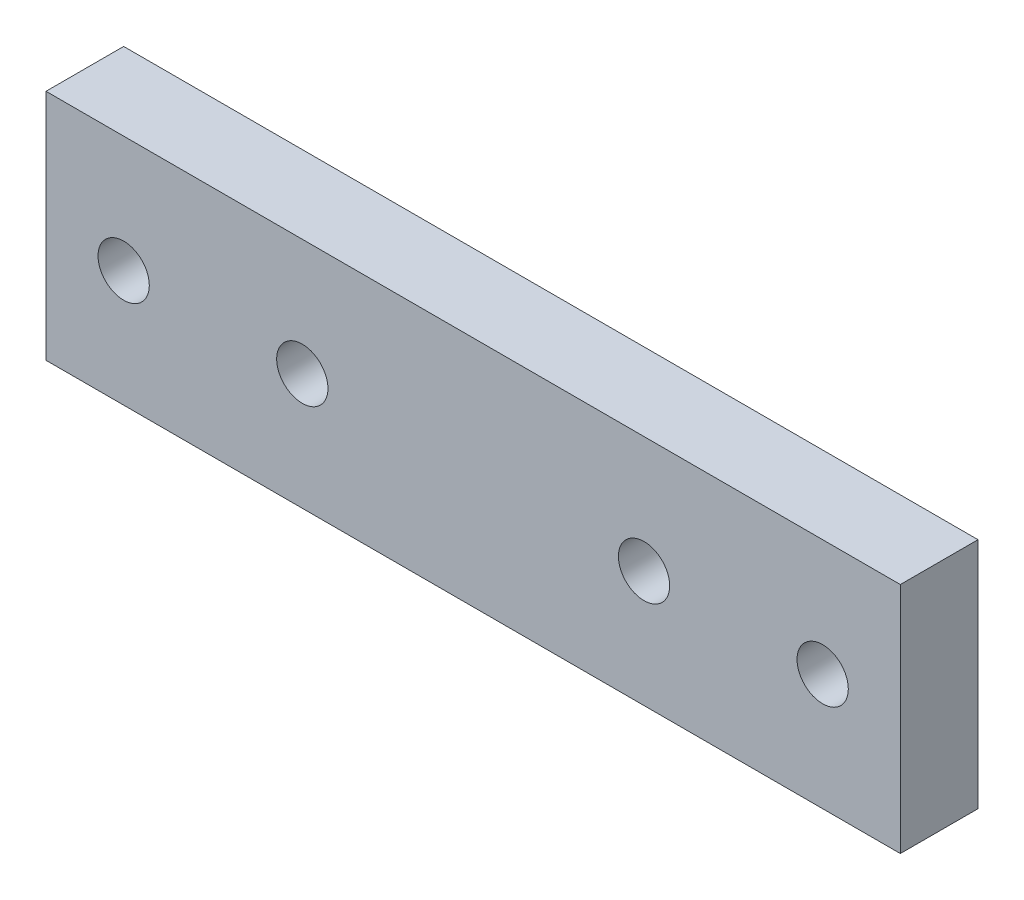
from build123d import *

# Parameters (mm, degrees)
SKETCH1_W           = 110
SKETCH1_H           = 30
BOSS_EXTRUDE1_DEPTH = 10
M6_CLEARANCE_HOLE_D = 6.6


with BuildPart() as part:
    # Sketch1 → Boss-Extrude1 (new body)
    with BuildSketch(Plane.XY):
        with Locations((-14.126560257, 689.486311854)):
            Rectangle(SKETCH1_W, SKETCH1_H)
    extrude(amount=BOSS_EXTRUDE1_DEPTH)

    # M6 Clearance Hole (through all)
    with Locations(Plane(origin=(545.719230148, 1586.957920749, 10), x_dir=(-1, 0, 0), z_dir=(0, 0, 1))):
        with Locations((514.845790405, 1450.886073068), (514.845790405, 1412.886073068), (537.845790405, 1453.886073068), (537.845790405, 1409.886073068), (581.845790405, 1453.886073068), (581.845790405, 1409.886073068), (604.845790405, 1450.886073068), (604.845790405, 1412.886073068), (514.845790405, 897.471608895), (537.845790405, 897.471608895), (581.845790405, 897.471608895), (604.845790405, 897.471608895), (394.752371414, 1482.156083565), (514.845790405, 1431.886073068), (537.845790405, 1431.886073068), (581.845790405, 1431.886073068), (604.845790405, 1431.886073068)):
            Hole(M6_CLEARANCE_HOLE_D / 2)


solid = part.part
